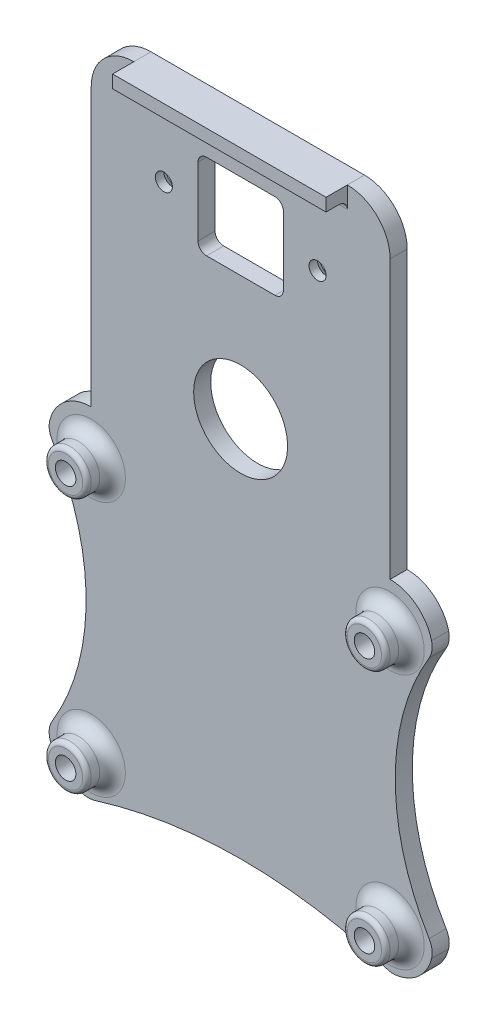
from build123d import *

# Parameters (mm, degrees)
SKETCH1_R           = 2.4
BOSS_EXTRUDE1_DEPTH = 4
SKETCH2_R           = 5.004606442
SKETCH2_R_2         = 2.4
SKETCH2_R_3         = 5
BOSS_EXTRUDE2_DEPTH = 6
FILLET1_R           = 3
FILLET2_R           = 1
FILLET3_R           = 5
BOSS_EXTRUDE3_DEPTH = 4
CUT_EXTRUDE1_REACH  = 125.842
SKETCH4_R           = 2
SKETCH4_R_2         = 11
CHAMFER2_SIZE       = 2
SKETCH5_W           = 50
SKETCH5_H           = 3
BOSS_EXTRUDE4_DEPTH = 5
FILLET4_R           = 2


with BuildPart() as part:
    # Sketch1 → Boss-Extrude1 (new body)
    with BuildSketch(Plane.XY):
        with BuildLine():
            Line((-35, 40), (35, 40))
            ThreePointArc((35, 40), (42.071067812, 37.071067812), (45, 30))
            ThreePointArc((45, 30), (36.198456921, 0.155359306), (45, -29.689281388))
            ThreePointArc((45, -29.689281388), (42.158200619, -36.675130552), (35.244966425, -39.689281388))
            ThreePointArc((35.244966425, -39.689281388), (0.122483213, -34.194583419), (-35, -39.689281388))
            ThreePointArc((-35, -39.689281388), (-42.071067812, -36.7603492), (-45, -29.689281388))
            ThreePointArc((-45, -29.689281388), (-36.198456921, 0.155359306), (-45, 30))
            ThreePointArc((-45, 30), (-42.071067812, 37.071067812), (-35, 40))
        make_face()
        with Locations((-35, 29.5)):
            Circle(SKETCH1_R, mode=Mode.SUBTRACT)
        with Locations((35, 29.5)):
            Circle(SKETCH1_R, mode=Mode.SUBTRACT)
        with Locations((-35, -30.3)):
            Circle(SKETCH1_R, mode=Mode.SUBTRACT)
        with Locations((35, -30.3)):
            Circle(SKETCH1_R, mode=Mode.SUBTRACT)
    extrude(amount=BOSS_EXTRUDE1_DEPTH)

    # Sketch2 → Boss-Extrude2 (add)
    # profile 1 of 4: a face of its own
    with BuildSketch(Plane.XY.offset(4)):
        with Locations(Location((-35, 29.5, 0), (0, 0, 180))):
            Circle(SKETCH2_R)
        with Locations((-35, 29.5)):
            Circle(SKETCH2_R_2, mode=Mode.SUBTRACT)
    # profile 2 of 4: a face of its own
    with BuildSketch(Plane.XY.offset(4)):
        with Locations(Location((35, 29.5, 0), (0, 0, 180))):
            Circle(SKETCH2_R_3)
        with Locations((35, 29.5)):
            Circle(SKETCH2_R_2, mode=Mode.SUBTRACT)
    # profile 3 of 4: a face of its own
    with BuildSketch(Plane.XY.offset(4)):
        with Locations(Location((-35, -30.3, 0), (0, 0, 180))):
            Circle(SKETCH2_R_3)
        with Locations((-35, -30.3)):
            Circle(SKETCH2_R_2, mode=Mode.SUBTRACT)
    # profile 4 of 4: a face of its own
    with BuildSketch(Plane.XY.offset(4)):
        with Locations(Location((35, -30.3, 0), (0, 0, 180))):
            Circle(SKETCH2_R_3)
        with Locations((35, -30.3)):
            Circle(SKETCH2_R_2, mode=Mode.SUBTRACT)
    extrude(amount=BOSS_EXTRUDE2_DEPTH)

    # Fillet1
    fillet1_edges = [part.edges().sort_by_distance(p)[0] for p in [
        (-29.995393558, 29.5, 4),
        (40, 29.5, 4),
        (-30, -30.3, 4),
        (40, -30.3, 4),
    ]]
    fillet(fillet1_edges, radius=FILLET1_R)

    # Fillet2
    fillet2_edges = [part.edges().sort_by_distance(p)[0] for p in [
        (-29.995393558, 29.5, 10),
        (40, 29.5, 10),
        (-30, -30.3, 10),
        (40, -30.3, 10),
    ]]
    fillet(fillet2_edges, radius=FILLET2_R)

    # Fillet3
    fillet3_edges = [part.edges().sort_by_distance(p)[0] for p in [
        (45, 30, 2),
        (45, -29.689281388, 2),
        (35.244966425, -39.689281388, 2),
        (-35, -39.689281388, 2),
        (-45, -29.689281388, 2),
        (-45, 30, 2),
    ]]
    fillet(fillet3_edges, radius=FILLET3_R)

    # Sketch3 → Boss-Extrude3 (add)
    with BuildSketch(Plane(origin=(0, 0, 0), x_dir=(-1, 0, 0), z_dir=(0, 0, -1))):
        with BuildLine():
            Line((-35, 40), (35, 40))
            Line((35, 40), (35, 105))
            ThreePointArc((35, 105), (32.071067812, 112.071067812), (25, 115))
            Line((25, 115), (-25, 115))
            ThreePointArc((-25, 115), (-32.071067812, 112.071067812), (-35, 105))
            Line((-35, 105), (-35, 40))
        make_face()
    extrude(amount=-BOSS_EXTRUDE3_DEPTH)

    # Sketch4 → Cut-Extrude1 (cut, up to next)
    with BuildSketch(Plane(origin=(0, 0, 0), x_dir=(-1, 0, 0), z_dir=(0, 0, -1)), mode=Mode.PRIVATE) as cut_extrude1_sk1:
        with Locations((-18.012077439, 94.13)):
            Circle(SKETCH4_R)
    cut_extrude1_tool1 = extrude(cut_extrude1_sk1.sketch, amount=-CUT_EXTRUDE1_REACH, mode=Mode.PRIVATE) & part.part
    # Sketch4 → Cut-Extrude1 (cut, up to next)
    with BuildSketch(Plane(origin=(0, 0, 0), x_dir=(-1, 0, 0), z_dir=(0, 0, -1)), mode=Mode.PRIVATE) as cut_extrude1_sk2:
        with Locations((17.987922561, 94.13)):
            Circle(SKETCH4_R)
    cut_extrude1_tool2 = extrude(cut_extrude1_sk2.sketch, amount=-CUT_EXTRUDE1_REACH, mode=Mode.PRIVATE) & part.part
    # Sketch4 → Cut-Extrude1 (cut, up to next)
    with BuildSketch(Plane(origin=(0, 0, 0), x_dir=(-1, 0, 0), z_dir=(0, 0, -1)), mode=Mode.PRIVATE) as cut_extrude1_sk3:
        with Locations((0.010567412, 54.999350628)):
            Circle(SKETCH4_R_2)
    cut_extrude1_tool3 = extrude(cut_extrude1_sk3.sketch, amount=-CUT_EXTRUDE1_REACH, mode=Mode.PRIVATE) & part.part
    # Sketch4 → Cut-Extrude1 (cut, up to next)
    with BuildSketch(Plane(origin=(0, 0, 0), x_dir=(-1, 0, 0), z_dir=(0, 0, -1)), mode=Mode.PRIVATE) as cut_extrude1_sk4:
        with BuildLine():
            Line((-8.012077439, 84.13), (7.987922561, 84.13))
            ThreePointArc((7.987922561, 84.13), (9.402136123, 84.715786438), (9.987922561, 86.13))
            Line((9.987922561, 86.13), (9.987922561, 102.13))
            ThreePointArc((9.987922561, 102.13), (9.402136123, 103.544213562), (7.987922561, 104.13))
            Line((7.987922561, 104.13), (-8.012077439, 104.13))
            ThreePointArc((-8.012077439, 104.13), (-9.426291001, 103.544213562), (-10.012077439, 102.13))
            Line((-10.012077439, 102.13), (-10.012077439, 86.13))
            ThreePointArc((-10.012077439, 86.13), (-9.426291001, 84.715786438), (-8.012077439, 84.13))
        make_face()
    cut_extrude1_tool4 = extrude(cut_extrude1_sk4.sketch, amount=-CUT_EXTRUDE1_REACH, mode=Mode.PRIVATE) & part.part
    add(cut_extrude1_tool1.solids().sort_by_distance((18.012077, 94.13, 0))[0], mode=Mode.SUBTRACT)
    add(cut_extrude1_tool2.solids().sort_by_distance((-17.987923, 94.13, 0))[0], mode=Mode.SUBTRACT)
    add(cut_extrude1_tool3.solids().sort_by_distance((-0.010567, 54.999351, 0))[0], mode=Mode.SUBTRACT)
    add(cut_extrude1_tool4.solids().sort_by_distance((0.012077, 94.13, 0))[0], mode=Mode.SUBTRACT)

    # Chamfer2
    chamfer2_edges = [part.edges().sort_by_distance(p)[0] for p in [
        (20.012077439, 94.13, 0),
        (-15.987922561, 94.13, 0),
    ]]
    chamfer(chamfer2_edges, length=CHAMFER2_SIZE)

    # Sketch5 → Boss-Extrude4 (add)
    with BuildSketch(Plane.XY.offset(4)):
        with Locations((0, 113.5)):
            Rectangle(SKETCH5_W, SKETCH5_H)
    extrude(amount=BOSS_EXTRUDE4_DEPTH)

    # Fillet4
    fillet4_edges = [part.edges().sort_by_distance(p)[0] for p in [
        (0, 112, 4),
    ]]
    fillet(fillet4_edges, radius=FILLET4_R)


solid = part.part
